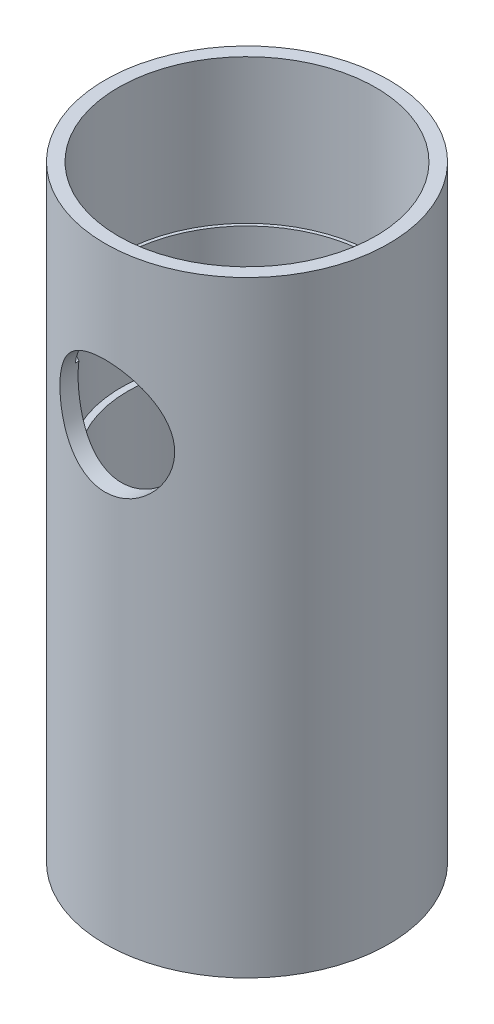
from build123d import *

# Parameters (mm, degrees)
SKETCH1_R           = 43.25
SKETCH1_R_2         = 38.25
BOSS_EXTRUDE1_DEPTH = 92.5
BOSS_EXTRUDE2_START = -6.35
SKETCH2_R           = 38.25
SKETCH2_R_2         = 36.25
BOSS_EXTRUDE2_DEPTH = 100
CUT_EXTRUDE3_START  = -44
SKETCH6_R           = 39.25
SKETCH6_R_2         = 38.25
CUT_EXTRUDE3_DEPTH  = 44
SKETCH8_R           = 17.5
CUT_EXTRUDE5_DEPTH  = 111.893530019


with BuildPart() as part:
    # Sketch1 → Boss-Extrude1 (new, symmetric)
    with BuildSketch(Plane(origin=(0, 0, 0), x_dir=(1, 0, 0), z_dir=(0, 1, 0))):
        with Locations(Location((0, 0, 0), (0, 0, 270))):
            Circle(SKETCH1_R)
        with Locations(Location((0, 0, 0), (0, 0, 270))):
            Circle(SKETCH1_R_2, mode=Mode.SUBTRACT)
    extrude(amount=BOSS_EXTRUDE1_DEPTH, both=True)

    # Sketch2 → Boss-Extrude2 (add)
    with BuildSketch(Plane.XZ.offset(92.5).offset(BOSS_EXTRUDE2_START)):
        with Locations(Location((0, 0, 0), (0, 0, 270))):
            Circle(SKETCH2_R)
        with Locations(Location((0, 0, 0), (0, 0, 270))):
            Circle(SKETCH2_R_2, mode=Mode.SUBTRACT)
    extrude(amount=-BOSS_EXTRUDE2_DEPTH)

    # Sketch6 → Cut-Extrude3 (cut)
    with BuildSketch(Plane(origin=(0, 92.5, 0), x_dir=(1, 0, 0), z_dir=(0, 1, 0)).offset(CUT_EXTRUDE3_START)):
        with Locations(Location((0, 0, 0), (0, 0, 270))):
            Circle(SKETCH6_R)
        with Locations(Location((0, 0, 0), (0, 0, 90))):
            Circle(SKETCH6_R_2, mode=Mode.SUBTRACT)
    extrude(amount=CUT_EXTRUDE3_DEPTH, mode=Mode.SUBTRACT)

    # Sketch8 → Cut-Extrude5 (cut, through all)
    with BuildSketch(Plane.XY):
        with Locations(Location((0, 44.35, 0), (0, 0, 90))):
            Circle(SKETCH8_R)
    extrude(amount=CUT_EXTRUDE5_DEPTH, mode=Mode.SUBTRACT)


solid = part.part
